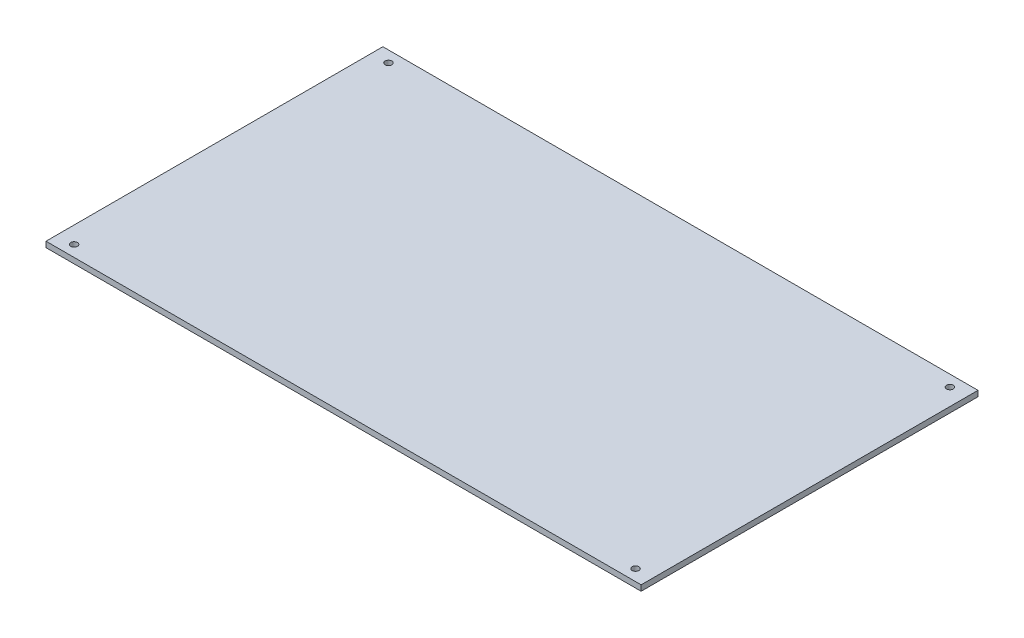
from build123d import *

# Parameters (mm, degrees)
CROQUIS1_W     = 1060
CROQUIS1_H     = 600
EXTRUIR1_DEPTH = 10
CROQUIS2_R     = 6
EXTRUIR2_DEPTH = 610.097693314


with BuildPart() as part:
    # Croquis1 → Extruir1 (new body)
    with BuildSketch(Plane(origin=(0, 0, 0), x_dir=(1, 0, 0), z_dir=(0, 1, 0))):
        Rectangle(CROQUIS1_W, CROQUIS1_H)
    extrude(amount=EXTRUIR1_DEPTH)

    # Croquis2 → Extruir2 (cut, through all)
    with BuildSketch(Plane(origin=(0, 10, 0), x_dir=(1, 0, 0), z_dir=(0, 1, 0))):
        with Locations(Location((-500, 280, 0), (0, 0, 270))):
            Circle(CROQUIS2_R)
        with Locations(Location((500, 280, 0), (0, 0, 90))):
            Circle(CROQUIS2_R)
        with Locations(Location((500, -280, 0), (0, 0, 270))):
            Circle(CROQUIS2_R)
        with Locations(Location((-500, -280, 0), (0, 0, 90))):
            Circle(CROQUIS2_R)
    extrude(amount=-EXTRUIR2_DEPTH, mode=Mode.SUBTRACT)


solid = part.part
